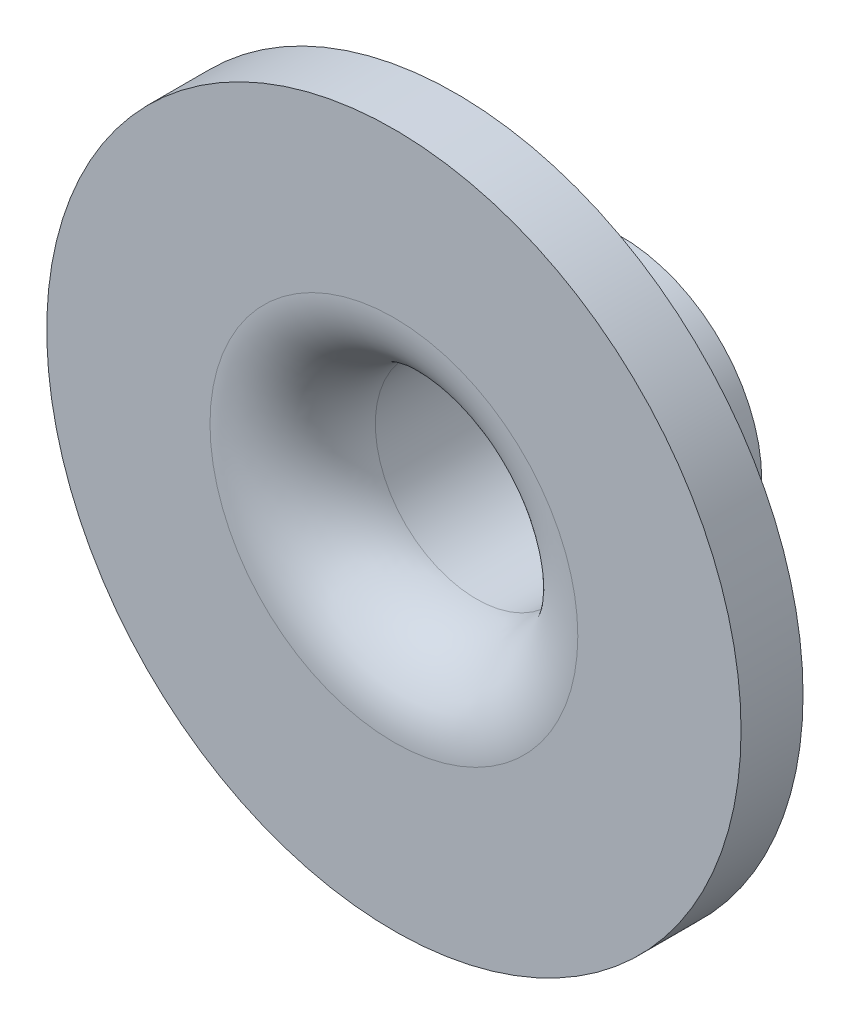
from build123d import *

# Parameters (mm, degrees)
SKETCH1_R           = 3.4
SKETCH1_R_2         = 2.45
BOSS_EXTRUDE1_DEPTH = 5.5
BOSS_EXTRUDE2_START = -1.5
SKETCH2_R           = 8.4
SKETCH2_R_2         = 3.4
BOSS_EXTRUDE2_DEPTH = 1.5
FILLET1_R           = 2
FILLET2_R           = 2


with BuildPart() as part:
    # Sketch1 → Boss-Extrude1 (new body)
    with BuildSketch(Plane.XY):
        Circle(SKETCH1_R)
        Circle(SKETCH1_R_2, mode=Mode.SUBTRACT)
    extrude(amount=BOSS_EXTRUDE1_DEPTH)

    # Sketch2 → Boss-Extrude2 (add)
    with BuildSketch(Plane.XY.offset(5.5).offset(BOSS_EXTRUDE2_START)):
        Circle(SKETCH2_R)
        Circle(SKETCH2_R_2, mode=Mode.SUBTRACT)
    extrude(amount=BOSS_EXTRUDE2_DEPTH)

    # Fillet1
    fillet1_edges = [part.edges().sort_by_distance(p)[0] for p in [
        (-3.4, 0, 4),
    ]]
    fillet(fillet1_edges, radius=FILLET1_R)

    # Fillet2
    fillet2_edges = [part.edges().sort_by_distance(p)[0] for p in [
        (-2.45, 0, 5.5),
    ]]
    fillet(fillet2_edges, radius=FILLET2_R)


solid = part.part
